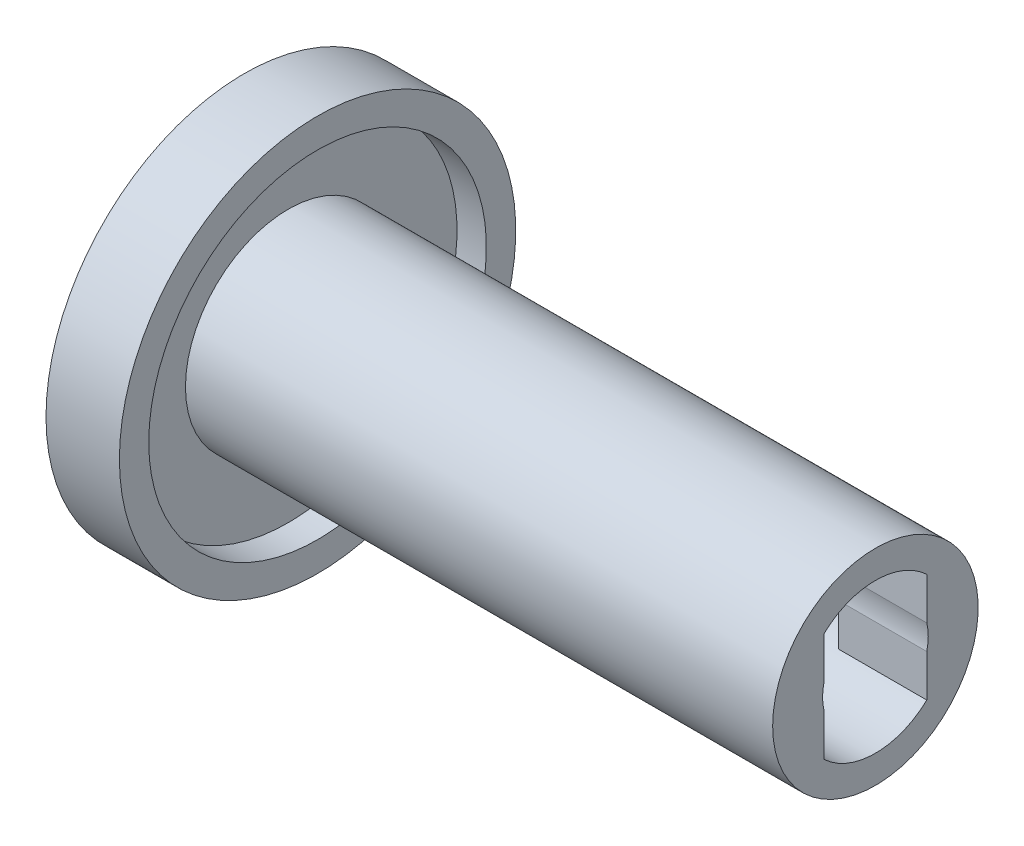
from build123d import *

# Parameters (mm, degrees)
CUT_EXTRUDE_START   = -6
CUT_EXTRUDE_1_DEPTH = 6


with BuildPart() as part:
    # 草图1 → 旋转1 (revolve)
    with BuildSketch(Plane.XY, mode=Mode.PRIVATE) as revolve_1_sk:
        Polygon((-59.358604437, 0), (-62.358604437, 0), (-62.358604437, 13.5), (-57.358604437, 13.5), (-57.358604437, 11.5), (-59.358604437, 11.5), (-59.358604437, 7), (-19.358604437, 7), (-19.358604437, 3.6), (-25.358604437, 3.6), (-25.358604437, 5.1), (-59.358604437, 5.1), align=None)
    revolve(revolve_1_sk.sketch.rotate(Axis((-81.741157905, 0, 0), (1, 0, 0)), 90), axis=Axis((-81.741157905, 0, 0), (1, 0, 0)))

    # 草图2 → 切除-拉伸1 (cut)
    with BuildSketch(Plane(origin=(-19.358604437, 0, 0), x_dir=(0, 0, -1), z_dir=(1, 0, 0)).offset(CUT_EXTRUDE_START)):
        with BuildLine():
            Line((-3.5, 3.709447398), (-3.5, -3.709447398))
            ThreePointArc((-3.5, -3.709447398), (0, -5.1), (3.5, -3.709447398))
            Line((3.5, -3.709447398), (3.5, 3.709447398))
            ThreePointArc((3.5, 3.709447398), (0, 5.1), (-3.5, 3.709447398))
        make_face()
    extrude(amount=CUT_EXTRUDE_1_DEPTH, mode=Mode.SUBTRACT)


solid = part.part
